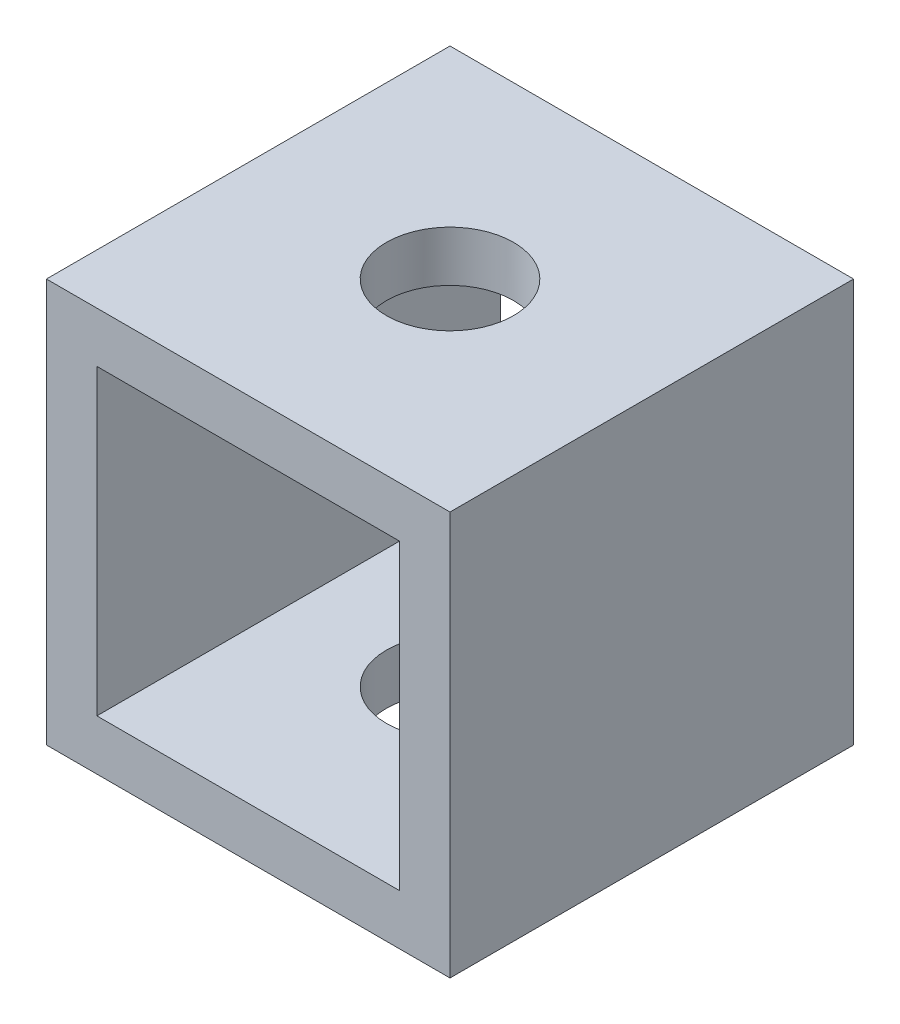
from build123d import *

# Parameters (mm, degrees)
SKETCH1_W           = 25.4
SKETCH1_H           = 25.4
SKETCH1_W_2         = 19.05
SKETCH1_H_2         = 19.05
BOSS_EXTRUDE1_DEPTH = 25.4
SKETCH3_R           = 4
CUT_EXTRUDE2_DEPTH  = 44.994090512


with BuildPart() as part:
    # Sketch1 → Boss-Extrude1 (new body)
    with BuildSketch(Plane.XY):
        with Locations((-12.7, 12.7)):
            Rectangle(SKETCH1_W, SKETCH1_H)
        with Locations((-12.7, 12.7)):
            Rectangle(SKETCH1_W_2, SKETCH1_H_2, mode=Mode.SUBTRACT)
    extrude(amount=BOSS_EXTRUDE1_DEPTH)

    # Sketch3 → Cut-Extrude2 (cut, through all)
    with BuildSketch(Plane(origin=(0, 25.4, 0), x_dir=(1, 0, 0), z_dir=(0, 1, 0))):
        with Locations(Location((-12.7, -12.7, 0), (0, 0, 180))):
            Circle(SKETCH3_R)
    extrude(amount=-CUT_EXTRUDE2_DEPTH, mode=Mode.SUBTRACT)


solid = part.part
